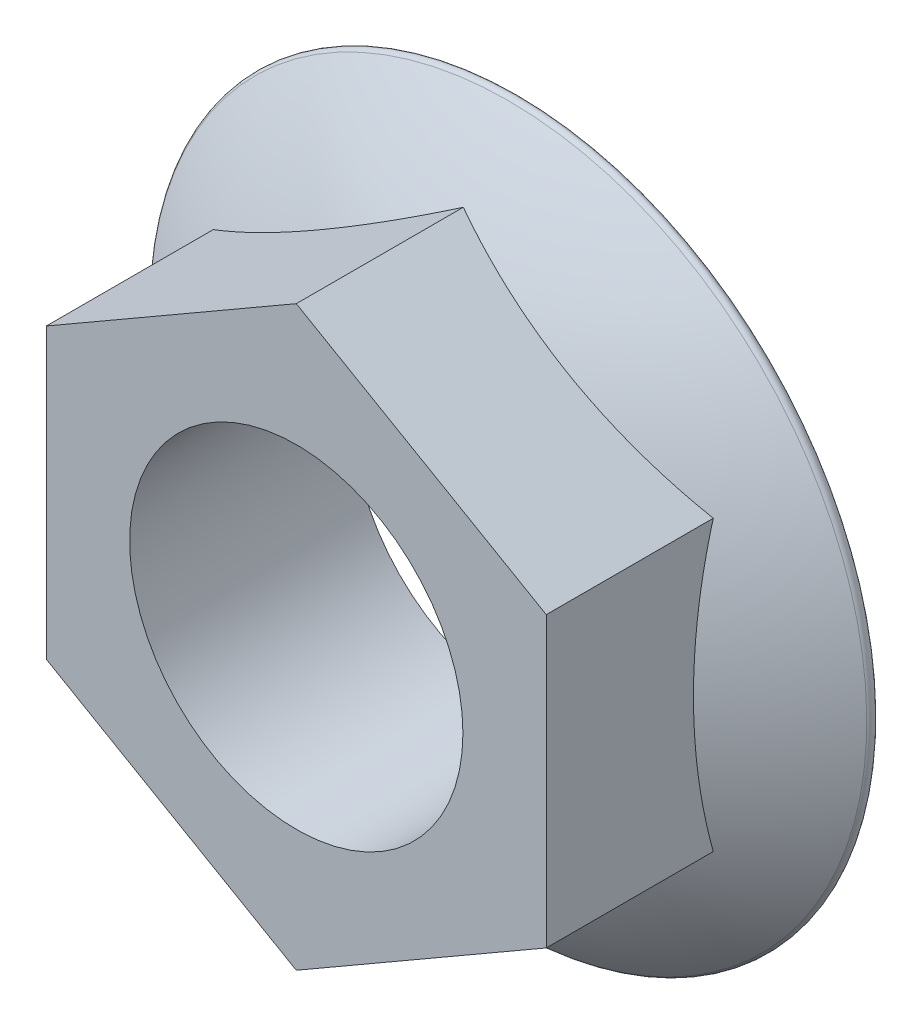
from build123d import *

# Parameters (mm, degrees)
BOSS_EXTRUDE2_DEPTH = 20
SKETCH3_R           = 15
CUT_EXTRUDE1_DEPTH  = 51.060014113


with BuildPart() as part:
    # Sketch1 → Boss-Extrude2 (new body)
    with BuildSketch(Plane.XY):
        Polygon((22.5, 12.990381057), (0, 25.980762114), (-22.5, 12.990381057), (-22.5, -12.990381057), (0, -25.980762114), (22.5, -12.990381057), align=None)
    extrude(amount=BOSS_EXTRUDE2_DEPTH)

    # Sketch2 → Revolve1 (revolve)
    with BuildSketch(Plane(origin=(0, 0, 0), x_dir=(0, 0, -1), z_dir=(1, 0, 0)), mode=Mode.PRIVATE) as revolve1_sk:
        with BuildLine():
            Line((0, 0), (-12, 0))
            ThreePointArc((-12, 0), (-8.979840166, -16.995527234), (-0.900236414, -32.249684523))
            ThreePointArc((-0.900236414, -32.249684523), (-0.342073129, -32.424403945), (0, -31.95))
            Line((0, -31.95), (0, 0))
        make_face()
    revolve(revolve1_sk.sketch.rotate(Axis((0, 0, 0), (0, 0, 1)), 180), axis=Axis((0, 0, 0), (0, 0, 1)))

    # Sketch3 → Cut-Extrude1 (cut, through all)
    with BuildSketch(Plane.XY.offset(20)):
        Circle(SKETCH3_R)
    extrude(amount=-CUT_EXTRUDE1_DEPTH, mode=Mode.SUBTRACT)


solid = part.part
